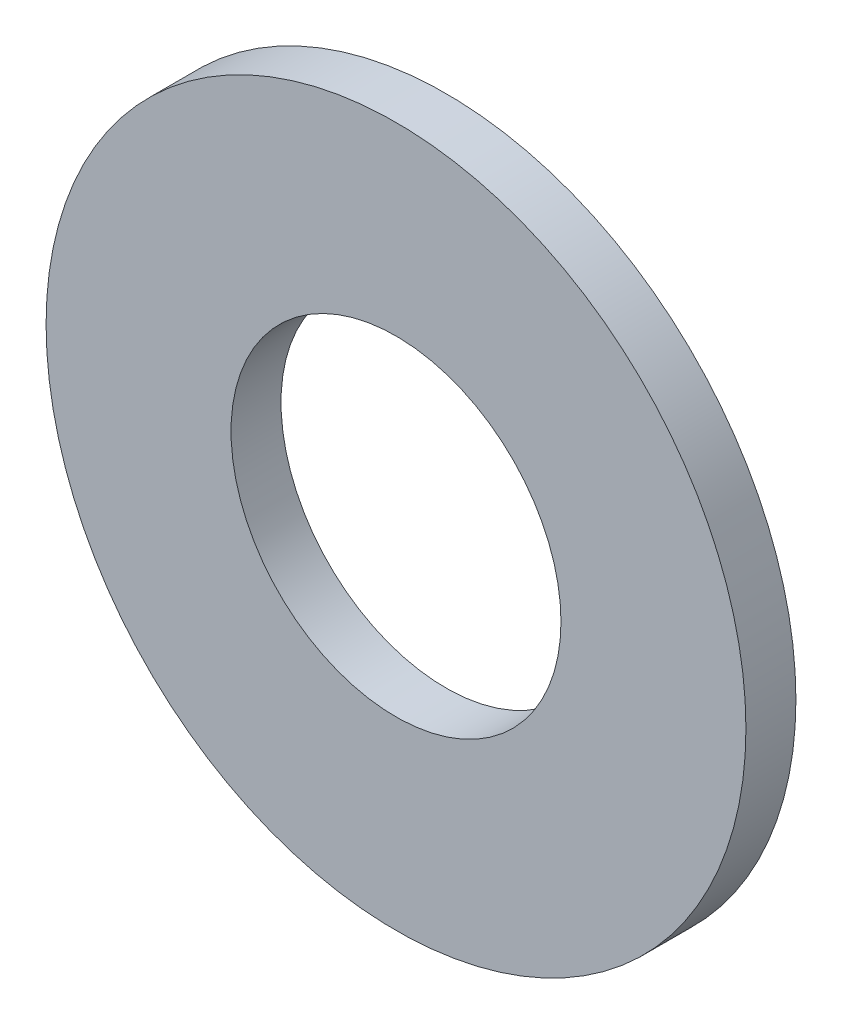
from build123d import *

# Parameters (mm, degrees)
SKETCH_1_R      = 3.5
SKETCH_1_R_2    = 1.65
EXTRUDE_1_DEPTH = 0.25


with BuildPart() as part:
    # 草图1 → 凸台-拉伸1 (new, symmetric)
    with BuildSketch(Plane.XY):
        Circle(SKETCH_1_R)
        Circle(SKETCH_1_R_2, mode=Mode.SUBTRACT)
    extrude(amount=EXTRUDE_1_DEPTH, both=True)


solid = part.part
